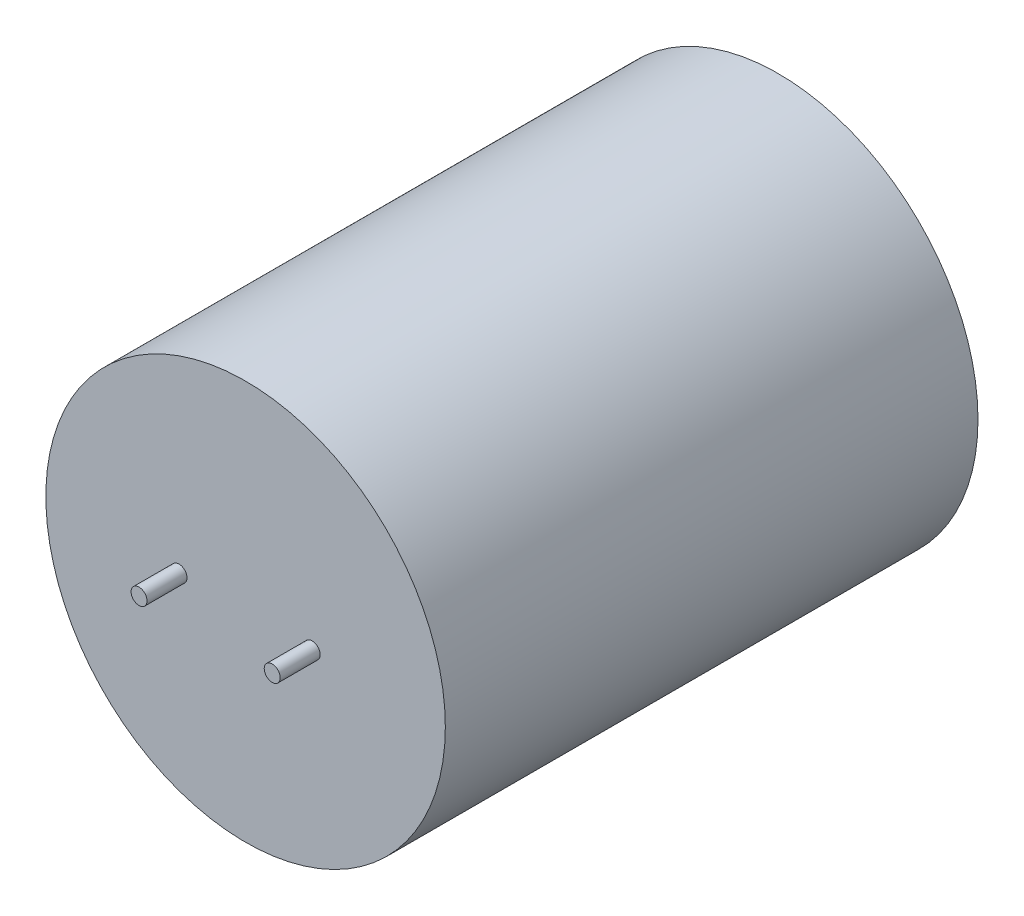
from build123d import *

# Parameters (mm, degrees)
SKETCH_1_R      = 15
EXTRUDE_1_DEPTH = 40
SKETCH_2_R      = 0.6
EXTRUDE_2_DEPTH = 3


with BuildPart() as part:
    # Эскиз1 → Вытянуть1 (new body)
    with BuildSketch(Plane.XY):
        Circle(SKETCH_1_R)
    extrude(amount=EXTRUDE_1_DEPTH)

    # Эскиз2 → Вытянуть2 (add)
    with BuildSketch(Plane.XY.offset(40)):
        with Locations((-5, 0)):
            Circle(SKETCH_2_R)
        with Locations((5, 0)):
            Circle(SKETCH_2_R)
    extrude(amount=EXTRUDE_2_DEPTH)


solid = part.part
